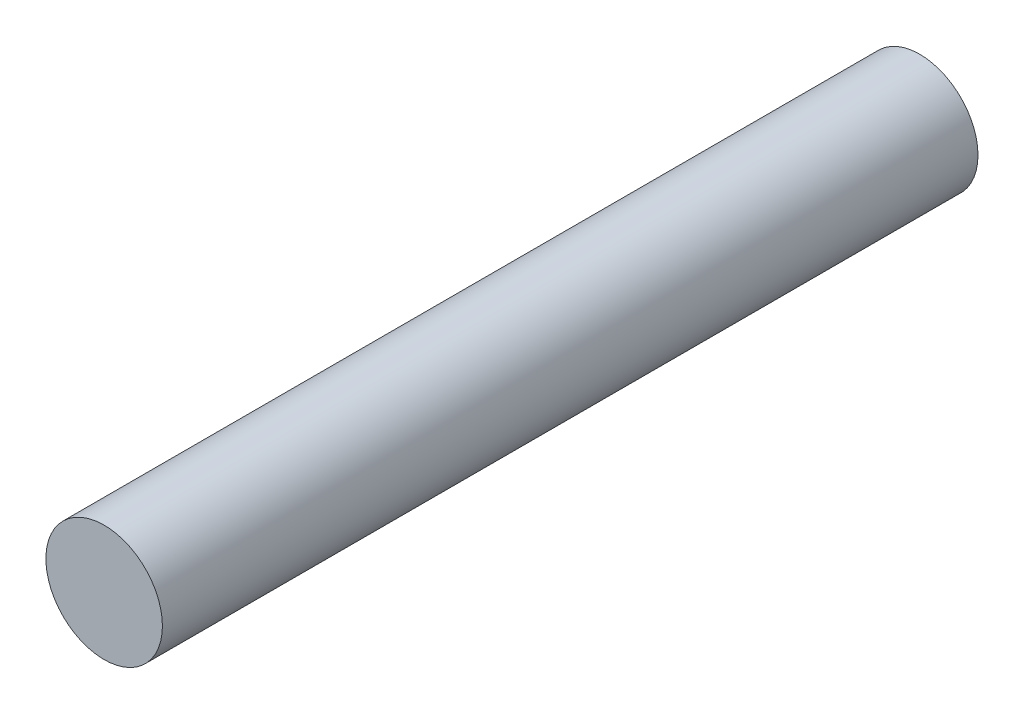
from build123d import *

# Parameters (mm, degrees)
SKETCH_1_R       = 2
EXTRUDE_28_DEPTH = 28


with BuildPart() as part:
    # 草图1 → 轴向尺寸_28 (new body)
    with BuildSketch(Plane.XY):
        Circle(SKETCH_1_R)
    extrude(amount=EXTRUDE_28_DEPTH)


solid = part.part
